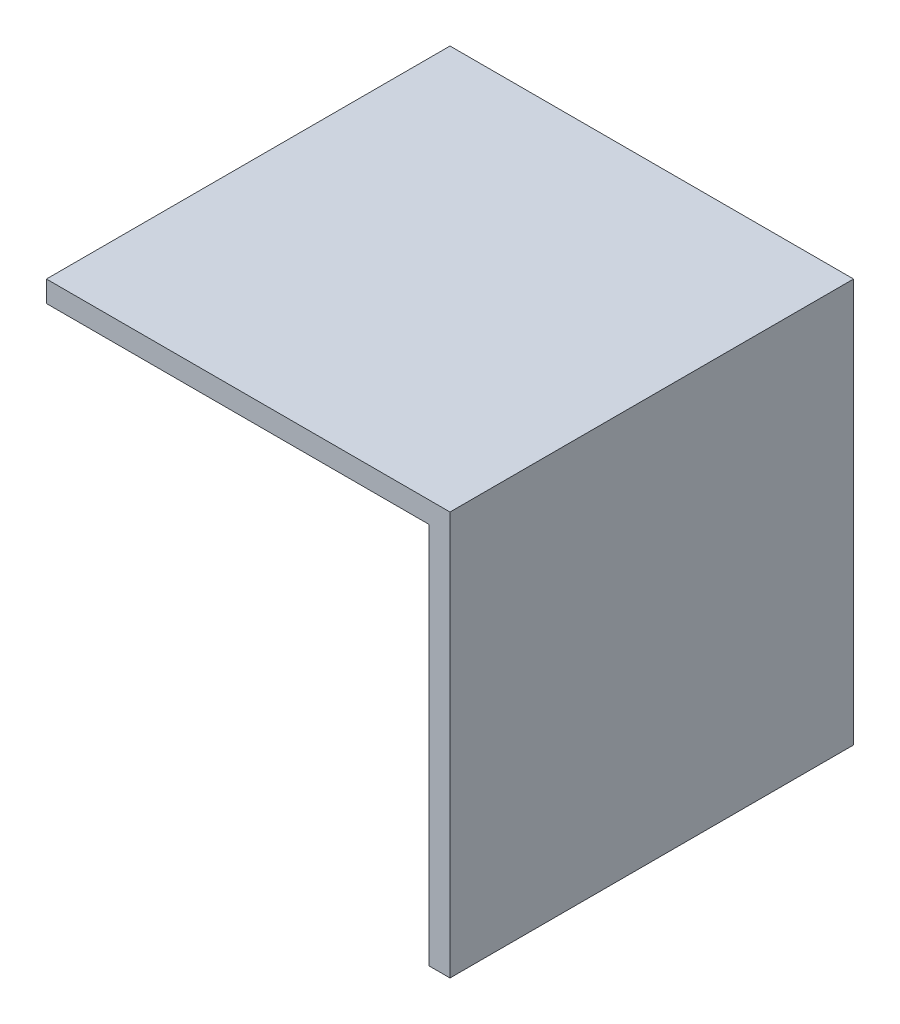
from build123d import *

# Parameters (mm, degrees)
SKETCH1_W           = 100
SKETCH1_H           = 100
BOSS_EXTRUDE1_DEPTH = 5
BOSS_EXTRUDE2_DEPTH = 95
SKETCH3_R           = 13.25
CUT_EXTRUDE1_DEPTH  = 95
CUT_EXTRUDE2_DEPTH  = 123.474487139
SKETCH5_W           = 5
SKETCH5_H           = 95
CUT_EXTRUDE3_DEPTH  = 147.714007511


with BuildPart() as part:
    # Sketch1 → Boss-Extrude1 (new body)
    with BuildSketch(Plane.XY):
        Rectangle(SKETCH1_W, SKETCH1_H)
    extrude(amount=BOSS_EXTRUDE1_DEPTH)

    # Sketch2 → Boss-Extrude2 (add)
    with BuildSketch(Plane.XY.offset(5)):
        Polygon((-50, 50), (50, 50), (50, -50), (45, -50), (45, 45), (-50, 45), align=None)
    extrude(amount=BOSS_EXTRUDE2_DEPTH)

    # Sketch3 → Cut-Extrude1 (cut)
    with BuildSketch(Plane(origin=(0, 0, 0), x_dir=(-1, 0, 0), z_dir=(0, 0, -1))):
        with Locations((0, 19.5)):
            Circle(SKETCH3_R)
    extrude(amount=-CUT_EXTRUDE1_DEPTH, mode=Mode.SUBTRACT)

    # Sketch4 → Cut-Extrude2 (cut, through all)
    with BuildSketch(Plane(origin=(0, 0, 0), x_dir=(-1, 0, 0), z_dir=(0, 0, -1))):
        Polygon((-50, -50), (50, -50), (50, 50), (45, 50), (45, -45), (-50, -45), align=None)
    extrude(amount=-CUT_EXTRUDE2_DEPTH, mode=Mode.SUBTRACT)

    # Sketch5 → Cut-Extrude3 (cut, through all)
    with BuildSketch(Plane(origin=(50, 0, 0), x_dir=(0, 0, -1), z_dir=(1, 0, 0))):
        with Locations((-97.5, 2.5)):
            Rectangle(SKETCH5_W, SKETCH5_H)
    extrude(amount=-CUT_EXTRUDE3_DEPTH, mode=Mode.SUBTRACT)


solid = part.part
